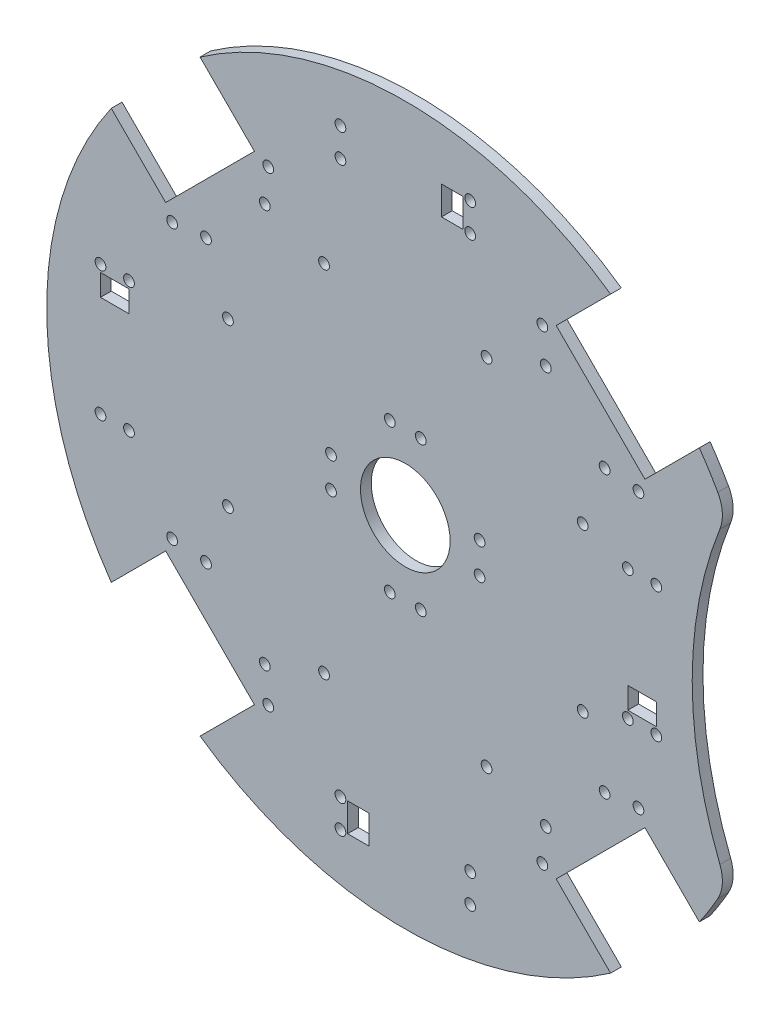
from build123d import *

# Parameters (mm, degrees)
CROQUIS1_R              = 100
SALIENTE_EXTRUIR1_DEPTH = 3
CROQUIS3_R              = 110
CORTAR_EXTRUIR1_DEPTH   = 3
REDONDEO1_R             = 10
CROQUIS4_R              = 1.5
CROQUIS4_R_2            = 12.5
CORTAR_EXTRUIR2_DEPTH   = 142.453172607
CROQUIS6_R              = 1.5
CROQUIS6_W              = 7.95
CROQUIS6_H              = 6
CROQUIS6_W_2            = 6
CROQUIS6_H_2            = 7.95
CORTAR_EXTRUIR3_DEPTH   = 10
CROQUIS8_R              = 1.5
CORTAR_EXTRUIR5_DEPTH   = 142.453172607


with BuildPart() as part:
    # Croquis1 → Saliente-Extruir1 (new body)
    with BuildSketch(Plane.XY):
        Circle(CROQUIS1_R)
    extrude(amount=SALIENTE_EXTRUIR1_DEPTH)

    # Croquis3 → Cortar-Extruir1 (cut)
    with BuildSketch(Plane.XY.offset(3)):
        with Locations((190, 0)):
            Circle(CROQUIS3_R)
    extrude(amount=-CORTAR_EXTRUIR1_DEPTH, mode=Mode.SUBTRACT)

    # Redondeo1
    redondeo1_edges = [part.edges().sort_by_distance(p)[0] for p in [
        (89.473684211, -44.659375654, 1.5),
        (89.473684211, 44.659375654, 1.5),
    ]]
    fillet(redondeo1_edges, radius=REDONDEO1_R)

    # Croquis4 → Cortar-Extruir2 (cut, through all)
    with BuildSketch(Plane.XY.offset(3)):
        with Locations((-65.01846853, -38.219121523)):
            Circle(CROQUIS4_R)
        with Locations((-49.462119344, -22.662772337)):
            Circle(CROQUIS4_R)
        with Locations((-22.662772337, -49.462119344)):
            Circle(CROQUIS4_R)
        with Locations((-38.219121523, -65.01846853)):
            Circle(CROQUIS4_R)
        with Locations((-22.662772337, 49.462119344)):
            Circle(CROQUIS4_R)
        with Locations((-38.219121523, 65.01846853)):
            Circle(CROQUIS4_R)
        with Locations((-49.462119344, 22.662772337)):
            Circle(CROQUIS4_R)
        with Locations((-65.01846853, 38.219121523)):
            Circle(CROQUIS4_R)
        with Locations((49.462119344, 22.662772337)):
            Circle(CROQUIS4_R)
        with Locations((65.01846853, 38.219121523)):
            Circle(CROQUIS4_R)
        with Locations((22.662772337, 49.462119344)):
            Circle(CROQUIS4_R)
        with Locations((38.219121523, 65.01846853)):
            Circle(CROQUIS4_R)
        with Locations((22.662772337, -49.462119344)):
            Circle(CROQUIS4_R)
        with Locations((38.219121523, -65.01846853)):
            Circle(CROQUIS4_R)
        with Locations((49.462119344, -22.662772337)):
            Circle(CROQUIS4_R)
        with Locations((65.01846853, -38.219121523)):
            Circle(CROQUIS4_R)
        Circle(CROQUIS4_R_2)
        Polygon((-58.336309448, -83.085046789), (-83.085046789, -58.336309448), (-66.821590822, -42.072853481), (-42.072853481, -66.821590822), align=None)
        Polygon((-66.821590822, 42.072853481), (-42.072853481, 66.821590822), (-58.336309448, 83.085046789), (-83.085046789, 58.336309448), align=None)
        Polygon((42.072853481, 66.821590822), (66.821590822, 42.072853481), (83.085046789, 58.336309448), (58.336309448, 83.085046789), align=None)
        Polygon((66.821590822, -42.072853481), (42.072853481, -66.821590822), (58.336309448, -83.085046789), (83.085046789, -58.336309448), align=None)
    extrude(amount=-CORTAR_EXTRUIR2_DEPTH, mode=Mode.SUBTRACT)

    # Croquis6 → Cortar-Extruir3 (cut)
    with BuildSketch(Plane.XY.offset(3)):
        with Locations((70, 18.09)):
            Circle(CROQUIS6_R)
        with Locations((62.05, 18.09)):
            Circle(CROQUIS6_R)
        with Locations((62.05, -18.09)):
            Circle(CROQUIS6_R)
        with Locations((-18.09, 85)):
            Circle(CROQUIS6_R)
        with Locations((-18.09, 77.05)):
            Circle(CROQUIS6_R)
        with Locations((18.09, 85)):
            Circle(CROQUIS6_R)
        with Locations((18.09, 77.05)):
            Circle(CROQUIS6_R)
        with Locations((70, -18.09)):
            Circle(CROQUIS6_R)
        with Locations((18.09, -77.05)):
            Circle(CROQUIS6_R)
        with Locations((18.09, -85)):
            Circle(CROQUIS6_R)
        with Locations((-18.09, -85)):
            Circle(CROQUIS6_R)
        with Locations((-18.09, -77.05)):
            Circle(CROQUIS6_R)
        with Locations((-77.05, -18.09)):
            Circle(CROQUIS6_R)
        with Locations((-85, -18.09)):
            Circle(CROQUIS6_R)
        with Locations((-85, 18.09)):
            Circle(CROQUIS6_R)
        with Locations((-77.05, 18.09)):
            Circle(CROQUIS6_R)
        with Locations((66.025, -13.09)):
            Rectangle(CROQUIS6_W, CROQUIS6_H)
        with Locations((13.09, 81.025)):
            Rectangle(CROQUIS6_W_2, CROQUIS6_H_2)
        with Locations((-13.09, -81.025)):
            Rectangle(CROQUIS6_W_2, CROQUIS6_H_2)
        with Locations((-81.025, 13.09)):
            Rectangle(CROQUIS6_W, CROQUIS6_H)
    extrude(amount=-CORTAR_EXTRUIR3_DEPTH, mode=Mode.SUBTRACT)

    # Croquis8 → Cortar-Extruir5 (cut, through all)
    with BuildSketch(Plane.XY.offset(3)):
        with Locations((-55.578593001, 39.173715678)):
            Circle(CROQUIS8_R)
        with Locations((-39.173715678, 55.578593001)):
            Circle(CROQUIS8_R)
        with Locations((-20.718228689, 4.313351365)):
            Circle(CROQUIS8_R)
        with Locations((-4.313351365, 20.718228689)):
            Circle(CROQUIS8_R)
        with Locations((39.173715678, 55.578593001)):
            Circle(CROQUIS8_R)
        with Locations((55.578593001, 39.173715678)):
            Circle(CROQUIS8_R)
        with Locations((20.718228689, 4.313351365)):
            Circle(CROQUIS8_R)
        with Locations((4.313351365, 20.718228689)):
            Circle(CROQUIS8_R)
        with Locations((55.578593001, -39.173715678)):
            Circle(CROQUIS8_R)
        with Locations((39.173715678, -55.578593001)):
            Circle(CROQUIS8_R)
        with Locations((4.313351365, -20.718228689)):
            Circle(CROQUIS8_R)
        with Locations((20.718228689, -4.313351365)):
            Circle(CROQUIS8_R)
        with Locations((-39.173715678, -55.578593001)):
            Circle(CROQUIS8_R)
        with Locations((-55.578593001, -39.173715678)):
            Circle(CROQUIS8_R)
        with Locations((-20.718228689, -4.313351365)):
            Circle(CROQUIS8_R)
        with Locations((-4.313351365, -20.718228689)):
            Circle(CROQUIS8_R)
    extrude(amount=-CORTAR_EXTRUIR5_DEPTH, mode=Mode.SUBTRACT)


solid = part.part
